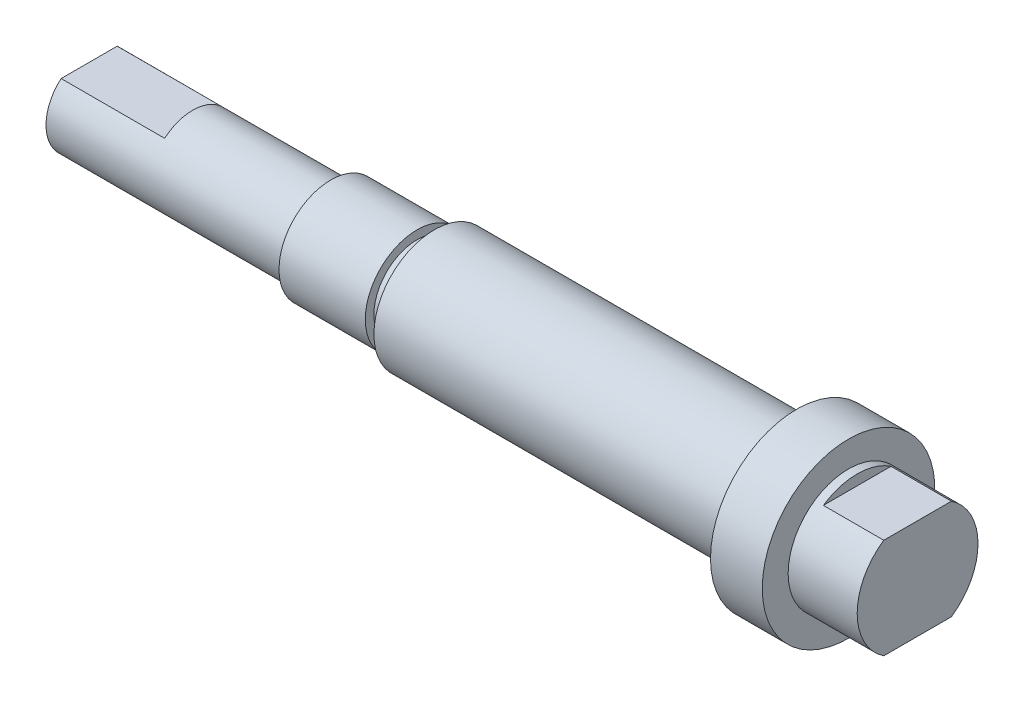
from build123d import *

# Parameters (mm, degrees)
SKETCH1_R           = 3.5
BOSS_EXTRUDE1_DEPTH = 50
BOSS_EXTRUDE2_START = 6
SKETCH2_R           = 5
BOSS_EXTRUDE2_DEPTH = 3
SKETCH5_R           = 3.5
SKETCH5_R_2         = 2.5
CUT_EXTRUDE2_DEPTH  = 20
BOSS_EXTRUDE3_START = 22
SKETCH3_R           = 3
BOSS_EXTRUDE3_DEPTH = 5
CUT_EXTRUDE3_START  = -5.5
CUT_EXTRUDE3_DEPTH  = 5.5
CUT_EXTRUDE4_START  = -2
CUT_EXTRUDE4_DEPTH  = 2
CUT_EXTRUDE5_DEPTH  = 6


with BuildPart() as part:
    # Sketch1 → Boss-Extrude1 (new body)
    with BuildSketch(Plane(origin=(0, 0, 0), x_dir=(0, 0, -1), z_dir=(1, 0, 0))):
        Circle(SKETCH1_R)
    extrude(amount=BOSS_EXTRUDE1_DEPTH)

    # Sketch2 → Boss-Extrude2 (add)
    with BuildSketch(Plane.ZY.offset(-50).offset(BOSS_EXTRUDE2_START)):
        Circle(SKETCH2_R)
    extrude(amount=BOSS_EXTRUDE2_DEPTH)

    # Sketch5 → Cut-Extrude2 (cut)
    with BuildSketch(Plane.ZY):
        Circle(SKETCH5_R)
        Circle(SKETCH5_R_2, mode=Mode.SUBTRACT)
    extrude(amount=-CUT_EXTRUDE2_DEPTH, mode=Mode.SUBTRACT)

    # Sketch3 → Boss-Extrude3 (add)
    with BuildSketch(Plane.ZY.offset(-41).offset(BOSS_EXTRUDE3_START)):
        Circle(SKETCH3_R)
    extrude(amount=BOSS_EXTRUDE3_DEPTH)

    # Sketch6 → Cut-Extrude3 (cut)
    with BuildSketch(Plane(origin=(50, 0, 0), x_dir=(0, 0, -1), z_dir=(1, 0, 0)).offset(CUT_EXTRUDE3_START)):
        with BuildLine():
            ThreePointArc((1.959591794, 2.9), (0, 3.5), (-1.959591794, 2.9))
            Line((-1.959591794, 2.9), (1.959591794, 2.9))
        make_face()
        with BuildLine():
            Line((1.959591794, -2.9), (-1.959591794, -2.9))
            ThreePointArc((-1.959591794, -2.9), (0, -3.5), (1.959591794, -2.9))
        make_face()
    extrude(amount=CUT_EXTRUDE3_DEPTH, mode=Mode.SUBTRACT)

    # Sketch7 → Cut-Extrude4 (cut)
    with BuildSketch(Plane(origin=(50, 0, 0), x_dir=(0, 0, -1), z_dir=(1, 0, 0)).offset(CUT_EXTRUDE4_START)):
        with BuildLine():
            Line((1.959591794, 2.9), (-1.959591794, 2.9))
            ThreePointArc((-1.959591794, 2.9), (-3.5, 0), (-1.959591794, -2.9))
            Line((-1.959591794, -2.9), (1.959591794, -2.9))
            ThreePointArc((1.959591794, -2.9), (3.5, 0), (1.959591794, 2.9))
        make_face()
    extrude(amount=CUT_EXTRUDE4_DEPTH, mode=Mode.SUBTRACT)

    # Sketch8 → Cut-Extrude5 (cut)
    with BuildSketch(Plane.ZY):
        with BuildLine():
            ThreePointArc((1.624807681, 1.9), (0, 2.5), (-1.624807681, 1.9))
            Line((-1.624807681, 1.9), (1.624807681, 1.9))
        make_face()
        with BuildLine():
            Line((1.624807681, -1.9), (-1.624807681, -1.9))
            ThreePointArc((-1.624807681, -1.9), (0, -2.5), (1.624807681, -1.9))
        make_face()
    extrude(amount=-CUT_EXTRUDE5_DEPTH, mode=Mode.SUBTRACT)


solid = part.part
